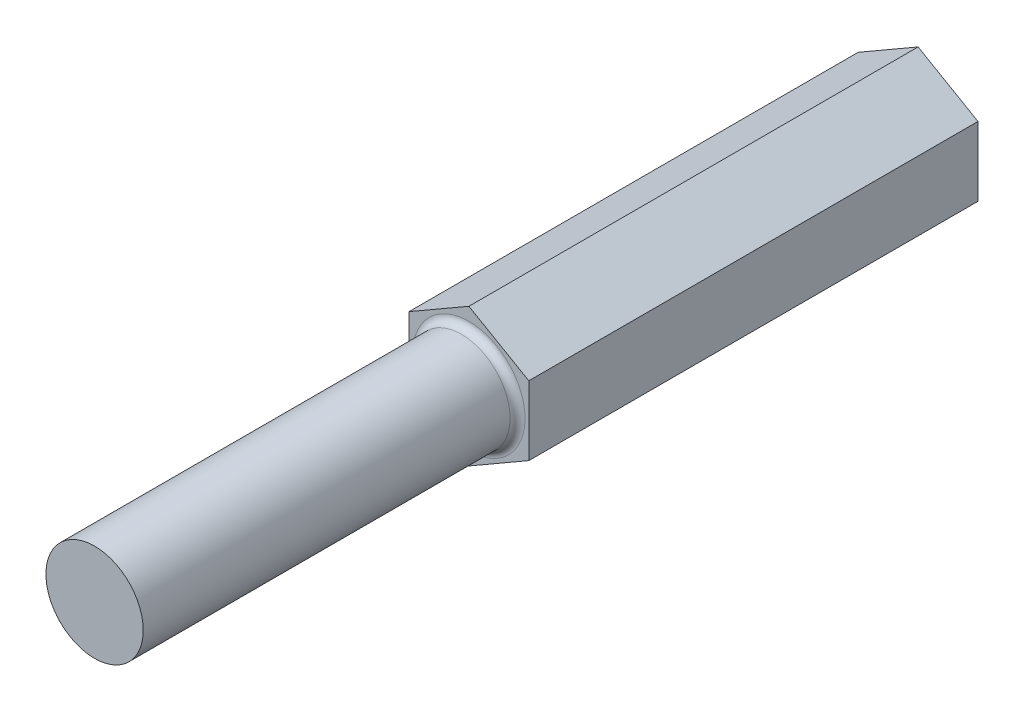
from build123d import *

# Parameters (mm, degrees)
BOSS_EXTRU_1_DEPTH = 30
ESQUISSE2_R        = 3.25
BOSS_EXTRU_2_DEPTH = 25
CONG_1_R           = 0.5


with BuildPart() as part:
    # Esquisse1 → Boss.-Extru.1 (new body)
    with BuildSketch(Plane.XY):
        Polygon((-4, 2.309401077), (-4, -2.309401077), (0, -4.618802154), (4, -2.309401077), (4, 2.309401077), (0, 4.618802154), align=None)
    extrude(amount=BOSS_EXTRU_1_DEPTH)

    # Esquisse2 → Boss.-Extru.2 (add)
    with BuildSketch(Plane.XY.offset(30)):
        Circle(ESQUISSE2_R)
    extrude(amount=BOSS_EXTRU_2_DEPTH)

    # Congé1
    cong_1_edges = [part.edges().sort_by_distance(p)[0] for p in [
        (-3.25, 0, 30),
    ]]
    fillet(cong_1_edges, radius=CONG_1_R)


solid = part.part
